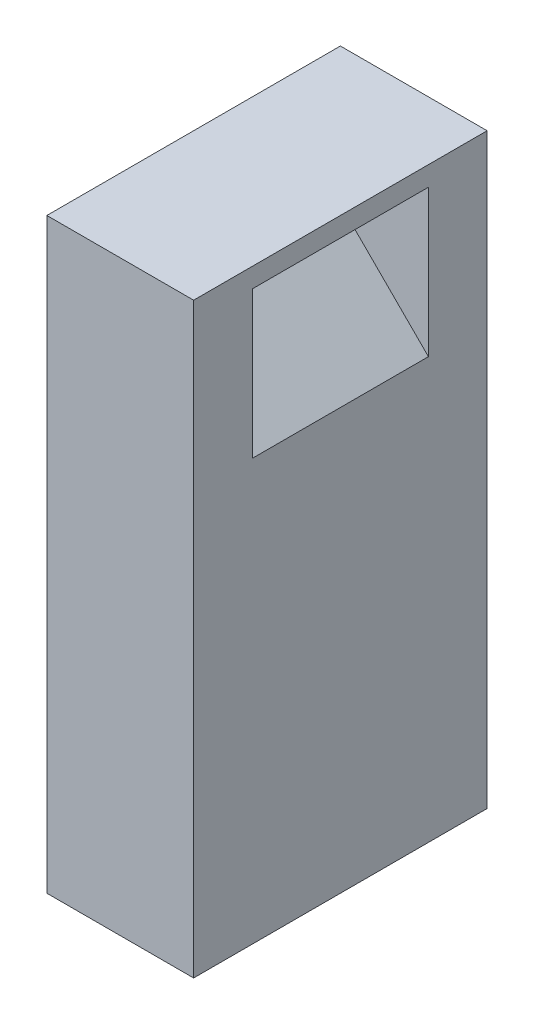
from build123d import *

# Parameters (mm, degrees)
SKETCH1_W           = 75
SKETCH1_H           = 300
BOSS_EXTRUDE1_DEPTH = 75
CUT_EXTRUDE1_START  = -75
CUT_EXTRUDE1_DEPTH  = 45


with BuildPart() as part:
    # Sketch1 → Boss-Extrude1 (new, symmetric)
    with BuildSketch(Plane.XY):
        with Locations((37.5, 150)):
            Rectangle(SKETCH1_W, SKETCH1_H)
    extrude(amount=BOSS_EXTRUDE1_DEPTH, both=True)

    # Sketch2 → Cut-Extrude1 (cut, symmetric)
    with BuildSketch(Plane.XY.offset(75).offset(CUT_EXTRUDE1_START)):
        Polygon((75, 290), (37.5, 252.5), (75, 215), align=None)
    extrude(amount=CUT_EXTRUDE1_DEPTH, both=True, mode=Mode.SUBTRACT)


solid = part.part
